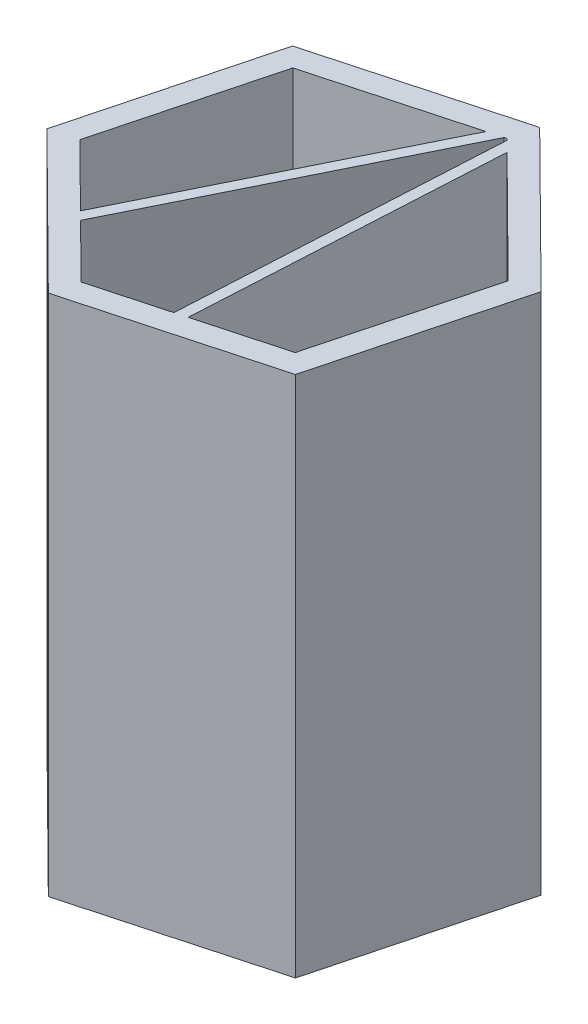
from build123d import *

# Parameters (mm, degrees)
BOSS_EXTRUDE1_DEPTH = 45
BOSS_EXTRUDE2_DEPTH = 45


with BuildPart() as part:
    # Sketch1 → Boss-Extrude1 (new body)
    with BuildSketch(Plane(origin=(0, 0, 0), x_dir=(1, 0, 0), z_dir=(0, 1, 0))):
        Polygon((12.308838273, -12.18574989), (16.707588105, 4.56689169), (4.398749832, 16.75264158), (-12.308838273, 12.18574989), (-16.707588105, -4.56689169), (-4.398749832, -16.75264158), align=None)
        Polygon((-3.812249855, -14.518956036), (10.667659836, -10.560983238), (14.479909691, 3.957972798), (3.812249855, 14.518956036), (-10.667659836, 10.560983238), (-14.479909691, -3.957972798), align=None, mode=Mode.SUBTRACT)
    extrude(amount=BOSS_EXTRUDE1_DEPTH)

    # Sketch2 → Boss-Extrude2 (add)
    with BuildSketch(Plane(origin=(0, 45, 0), x_dir=(1, 0, 0), z_dir=(0, 1, 0))):
        Polygon((-9.146079773, -9.238464417), (2.396071215, 14.131854414), (3.619327245, 14.466222113), (-8.435428664, -9.942009015), align=None)
        Polygon((3.427704991, -12.539969637), (4.855579014, 13.486060169), (3.954380077, 14.378247116), (2.463091942, -12.803639252), align=None)
    extrude(amount=-BOSS_EXTRUDE2_DEPTH)


solid = part.part
